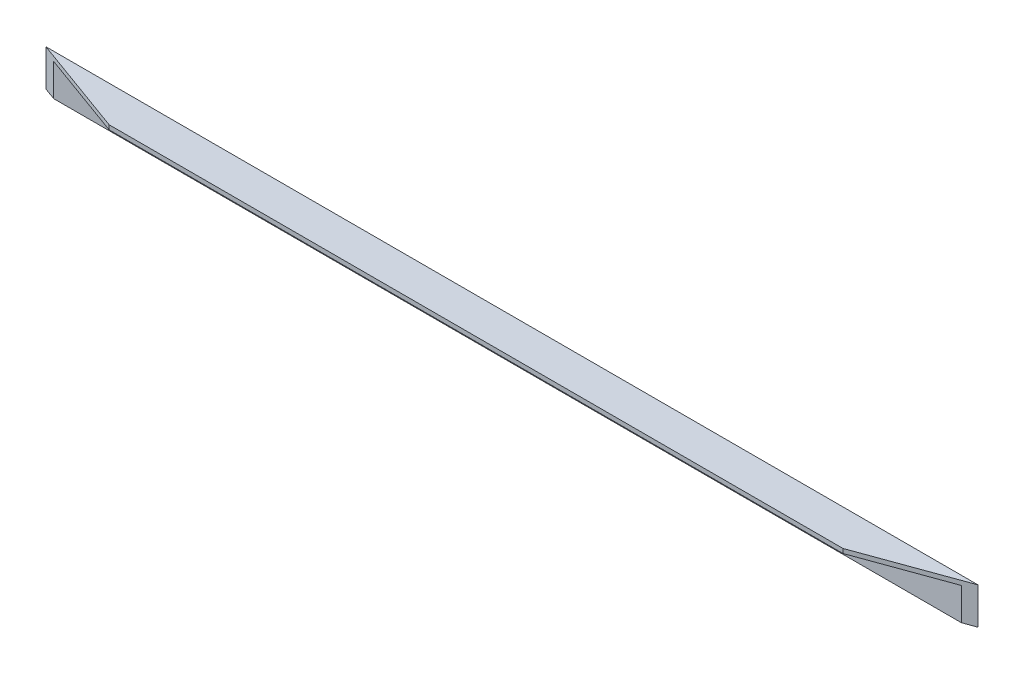
from build123d import *

# Parameters (mm, degrees)
SKETCH_1_W          = 2540
SKETCH_1_H          = 100
EXTRUDE_453_DEPTH   = 12
SKETCH_2_W          = 2540
SKETCH_2_H          = 12
EXTRUDE_1_DEPTH     = 86
CUT_EXTRUDE_1_DEPTH = 1278.694799238


with BuildPart() as part:
    # 草图1 → Extrude 453 (new body)
    with BuildSketch(Plane.XY):
        Rectangle(SKETCH_1_W, SKETCH_1_H)
    extrude(amount=EXTRUDE_453_DEPTH)

    # 草图2 → 凸台-拉伸1 (add)
    with BuildSketch(Plane.XY.offset(12)):
        with Locations((0, 44)):
            Rectangle(SKETCH_2_W, SKETCH_2_H)
    extrude(amount=EXTRUDE_1_DEPTH)

    # 草图4 → 切除-拉伸1 (cut, through all)
    with BuildSketch(Plane(origin=(0, 50, 0), x_dir=(-1, 0, 0), z_dir=(0, 1, 0))):
        Polygon((-1270, 0), (-1270, 98), (-1000, 98), align=None)
        Polygon((1270, 0), (1000, 98), (1270, 98), align=None)
    extrude(amount=-CUT_EXTRUDE_1_DEPTH, mode=Mode.SUBTRACT)


solid = part.part
